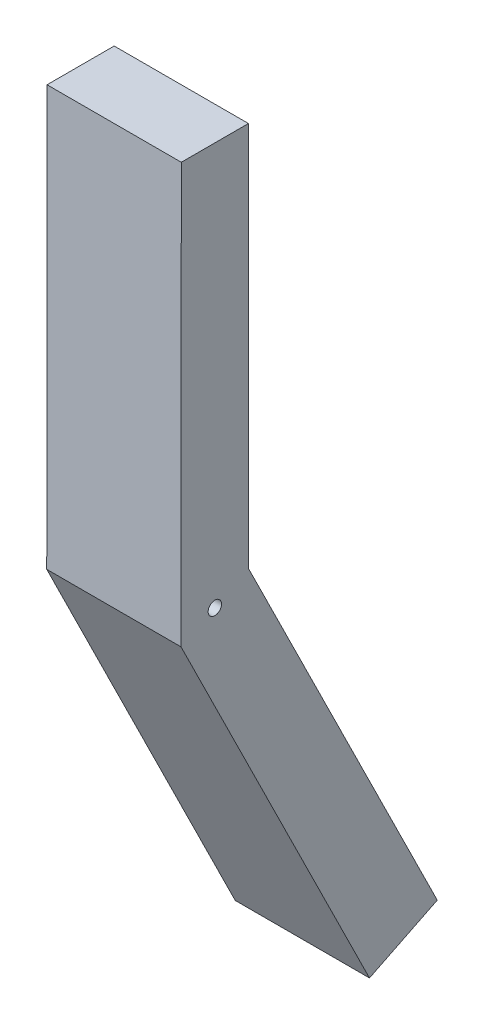
from build123d import *

# Parameters (mm, degrees)
BOSS_EXTRU_1_DEPTH      = 10
BOSS_EXTRU_1_DEPTH_BACK = 10
ESQUISSE1_R             = 1


with BuildPart() as part:
    # Esquisse1 → Boss.-Extru.1 (new, two sides: drawn at the far end of the back side and taken through both)
    with BuildSketch(Plane(origin=(0, 0, 0), x_dir=(0, 0, -1), z_dir=(1, 0, 0)).offset(-BOSS_EXTRU_1_DEPTH_BACK)):
        Polygon((5.047823589, 2.497154895), (33.133709904, -54.276495693), (23.038062725, -59.270805483), (-5.047823589, -2.497154895), (-5, 60), (5, 60), align=None)
        Circle(ESQUISSE1_R, mode=Mode.SUBTRACT)
    extrude(amount=BOSS_EXTRU_1_DEPTH + BOSS_EXTRU_1_DEPTH_BACK)


solid = part.part
